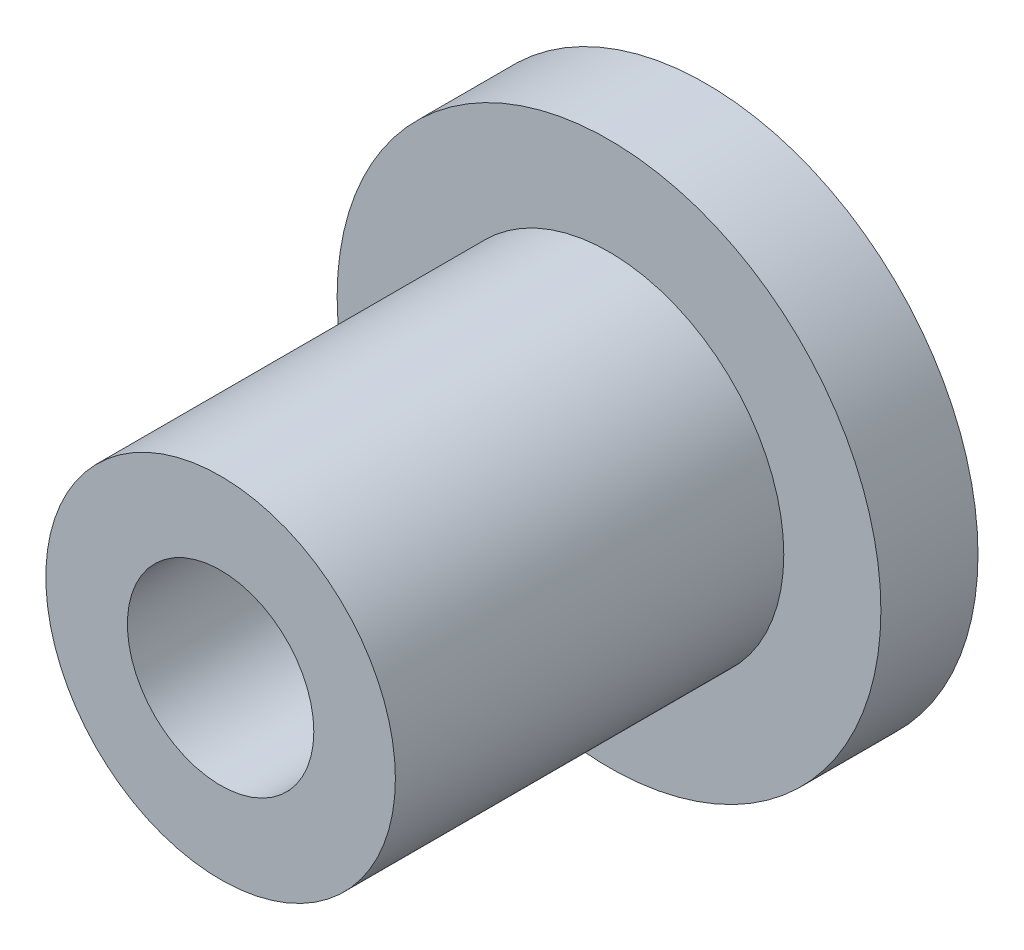
from build123d import *

# Parameters (mm, degrees)
SKETCH1_R           = 7
BOSS_EXTRUDE1_DEPTH = 2.5
SKETCH2_R           = 4.5
BOSS_EXTRUDE2_DEPTH = 10
SKETCH3_R           = 2.4
CUT_EXTRUDE1_DEPTH  = 5


with BuildPart() as part:
    # Sketch1 → Boss-Extrude1 (new body)
    with BuildSketch(Plane.XY):
        Circle(SKETCH1_R)
    extrude(amount=BOSS_EXTRUDE1_DEPTH)

    # Sketch2 → Boss-Extrude2 (add)
    with BuildSketch(Plane.XY.offset(2.5)):
        Circle(SKETCH2_R)
    extrude(amount=BOSS_EXTRUDE2_DEPTH)

    # Sketch3 → Cut-Extrude1 (cut)
    with BuildSketch(Plane.XY.offset(12.5)):
        Circle(SKETCH3_R)
    extrude(amount=-CUT_EXTRUDE1_DEPTH, mode=Mode.SUBTRACT)


solid = part.part
